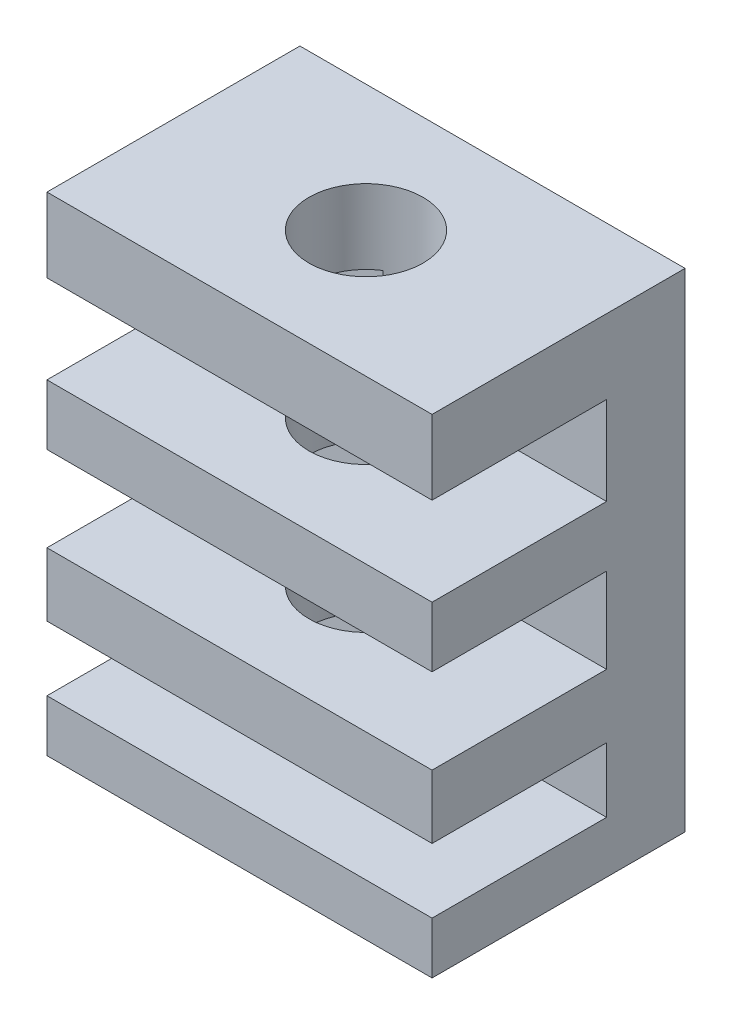
from build123d import *

# Parameters (mm, degrees)
BOSS_EXTRUDE2_DEPTH     = 20
CUT_EXTRUDE1_DEPTH      = 35.858058648
CUT_EXTRUDE1_DEPTH_BACK = 35.858058648
SKETCH3_R               = 2.962169801


with BuildPart() as part:
    # Sketch2 → Boss-Extrude2 (new body)
    with BuildSketch(Plane(origin=(0, 0, 0), x_dir=(0, 0, -1), z_dir=(1, 0, 0))):
        Polygon((0, 0), (0, 25.347810212), (-13.136695555, 25.347810212), (-13.136695555, 21.488272358), (-4.075171897, 21.488272358), (-4.075171897, 16.901575198), (-13.136695555, 16.901575198), (-13.136695555, 13.76919665), (-4.075171897, 13.76919665), (-4.075171897, 9.350305483), (-13.136695555, 9.350305483), (-13.136695555, 6.050120941), (-4.075171897, 6.050120941), (-4.075171897, 2.694001068), (-13.136695555, 2.694001068), (-13.136695555, 0), align=None)
    extrude(amount=BOSS_EXTRUDE2_DEPTH)

    # Sketch3 → Cut-Extrude1 (cut, two sides: drawn at the far end of the back side and taken through both)
    with BuildSketch(Plane(origin=(0, 25.347810212, 0), x_dir=(1, 0, 0), z_dir=(0, 1, 0)).offset(-CUT_EXTRUDE1_DEPTH_BACK)):
        with Locations(Location((10, -6.568347778, 0), (0, 0, 270))):
            Circle(SKETCH3_R)
    extrude(amount=CUT_EXTRUDE1_DEPTH + CUT_EXTRUDE1_DEPTH_BACK, mode=Mode.SUBTRACT)


solid = part.part
